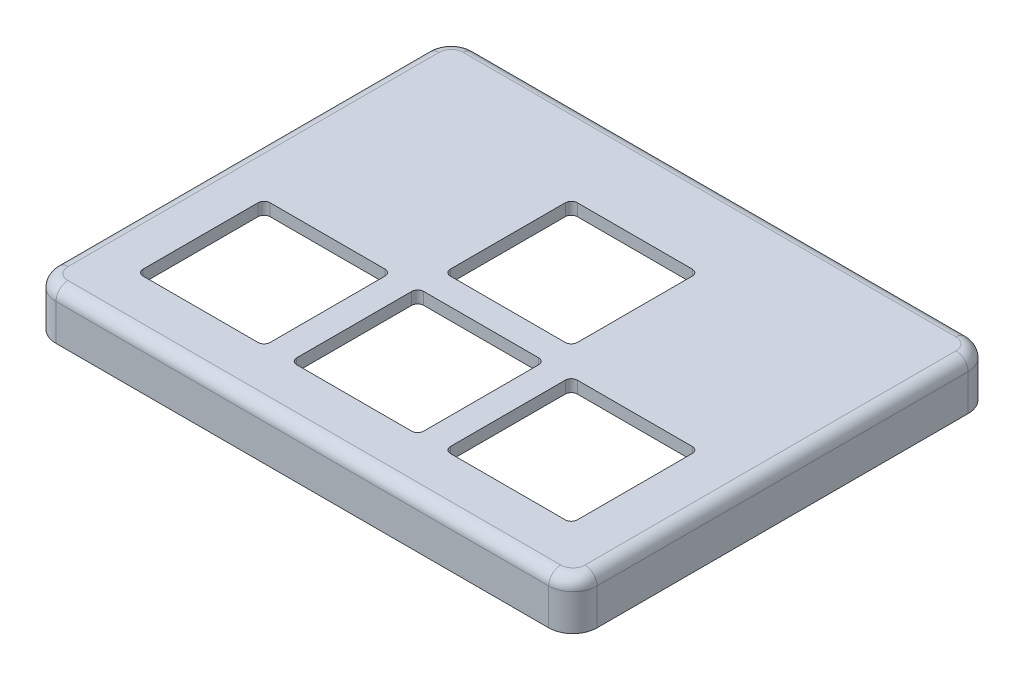
from build123d import *

# Parameters (mm, degrees)
BOSS_EXTRUDE1_DEPTH = 6
CUT_EXTRUDE1_DEPTH  = 4.5
CUT_EXTRUDE2_DEPTH  = 1.5
FILLET1_R           = 1.5
SKETCH4_W           = 0.6
SKETCH4_H           = 40
SKETCH4_W_2         = 55
SKETCH4_H_2         = 0.6
CUT_EXTRUDE3_DEPTH  = 2.5


with BuildPart() as part:
    # Sketch1 → Boss-Extrude1 (new body)
    with BuildSketch(Plane(origin=(0, 0, 0), x_dir=(1, 0, 0), z_dir=(0, 1, 0))):
        with BuildLine():
            Line((3, 0), (64.1, 0))
            ThreePointArc((64.1, 0), (66.221320344, 0.878679656), (67.1, 3))
            Line((67.1, 3), (67.1, 49))
            ThreePointArc((67.1, 49), (66.221320344, 51.121320344), (64.1, 52))
            Line((64.1, 52), (3, 52))
            ThreePointArc((3, 52), (0.878679656, 51.121320344), (0, 49))
            Line((0, 49), (0, 3))
            ThreePointArc((0, 3), (0.878679656, 0.878679656), (3, 0))
        make_face()
    extrude(amount=BOSS_EXTRUDE1_DEPTH)

    # Sketch2 → Cut-Extrude1 (cut)
    with BuildSketch(Plane(origin=(0, 0, 0), x_dir=(-1, 0, 0), z_dir=(0, -1, 0))):
        with BuildLine():
            Line((-4.9, 1.9), (-62.2, 1.9))
            ThreePointArc((-62.2, 1.9), (-64.321320344, 2.778679656), (-65.2, 4.9))
            Line((-65.2, 4.9), (-65.2, 48.1))
            ThreePointArc((-65.2, 48.1), (-64.321320344, 50.221320344), (-62.2, 51.1))
            Line((-62.2, 51.1), (-4.9, 51.1))
            ThreePointArc((-4.9, 51.1), (-2.778679656, 50.221320344), (-1.9, 48.1))
            Line((-1.9, 48.1), (-1.9, 4.9))
            ThreePointArc((-1.9, 4.9), (-2.778679656, 2.778679656), (-4.9, 1.9))
        make_face()
    extrude(amount=-CUT_EXTRUDE1_DEPTH, mode=Mode.SUBTRACT)

    # Sketch3 → Cut-Extrude2 (cut)
    with BuildSketch(Plane(origin=(0, 6, 0), x_dir=(1, 0, 0), z_dir=(0, 1, 0))):
        with BuildLine():
            Line((26.225, 41.43), (40.475, 41.43))
            ThreePointArc((40.475, 41.43), (41.005330086, 41.210330086), (41.225, 40.68))
            Line((41.225, 40.68), (41.225, 26.43))
            ThreePointArc((41.225, 26.43), (41.005330086, 25.899669914), (40.475, 25.68))
            Line((40.475, 25.68), (26.225, 25.68))
            ThreePointArc((26.225, 25.68), (25.694669914, 25.899669914), (25.475, 26.43))
            Line((25.475, 26.43), (25.475, 40.68))
            ThreePointArc((25.475, 40.68), (25.694669914, 41.210330086), (26.225, 41.43))
        make_face()
        with BuildLine():
            Line((7.175, 22.38), (21.425, 22.38))
            ThreePointArc((21.425, 22.38), (21.955330086, 22.160330086), (22.175, 21.63))
            Line((22.175, 21.63), (22.175, 7.38))
            ThreePointArc((22.175, 7.38), (21.955330086, 6.849669914), (21.425, 6.63))
            Line((21.425, 6.63), (7.175, 6.63))
            ThreePointArc((7.175, 6.63), (6.644669914, 6.849669914), (6.425, 7.38))
            Line((6.425, 7.38), (6.425, 21.63))
            ThreePointArc((6.425, 21.63), (6.644669914, 22.160330086), (7.175, 22.38))
        make_face()
        with BuildLine():
            Line((26.225, 22.38), (40.475, 22.38))
            ThreePointArc((40.475, 22.38), (41.005330086, 22.160330086), (41.225, 21.63))
            Line((41.225, 21.63), (41.225, 7.38))
            ThreePointArc((41.225, 7.38), (41.005330086, 6.849669914), (40.475, 6.63))
            Line((40.475, 6.63), (26.225, 6.63))
            ThreePointArc((26.225, 6.63), (25.694669914, 6.849669914), (25.475, 7.38))
            Line((25.475, 7.38), (25.475, 21.63))
            ThreePointArc((25.475, 21.63), (25.694669914, 22.160330086), (26.225, 22.38))
        make_face()
        with BuildLine():
            Line((45.275, 22.38), (59.525, 22.38))
            ThreePointArc((59.525, 22.38), (60.055330086, 22.160330086), (60.275, 21.63))
            Line((60.275, 21.63), (60.275, 7.38))
            ThreePointArc((60.275, 7.38), (60.055330086, 6.849669914), (59.525, 6.63))
            Line((59.525, 6.63), (45.275, 6.63))
            ThreePointArc((45.275, 6.63), (44.744669914, 6.849669914), (44.525, 7.38))
            Line((44.525, 7.38), (44.525, 21.63))
            ThreePointArc((44.525, 21.63), (44.744669914, 22.160330086), (45.275, 22.38))
        make_face()
    extrude(amount=-CUT_EXTRUDE2_DEPTH, mode=Mode.SUBTRACT)

    # Fillet1
    fillet1_edges = [part.edges().sort_by_distance(p)[0] for p in [
        (66.221320344, 6, -0.878679656),
        (67.1, 6, -26),
        (66.221320344, 6, -51.121320344),
        (33.55, 6, -52),
        (0.878679656, 6, -51.121320344),
        (0, 6, -26),
        (0.878679656, 6, -0.878679656),
        (33.55, 6, 0),
    ]]
    fillet(fillet1_edges, radius=FILLET1_R)

    # Sketch4 → Cut-Extrude3 (cut)
    with BuildSketch(Plane.XZ):
        with Locations((1, -26)):
            Rectangle(SKETCH4_W, SKETCH4_H)
        with Locations((33.55, -1)):
            Rectangle(SKETCH4_W_2, SKETCH4_H_2)
        with Locations((66.1, -26)):
            Rectangle(SKETCH4_W, SKETCH4_H)
    extrude(amount=-CUT_EXTRUDE3_DEPTH, mode=Mode.SUBTRACT)


solid = part.part
